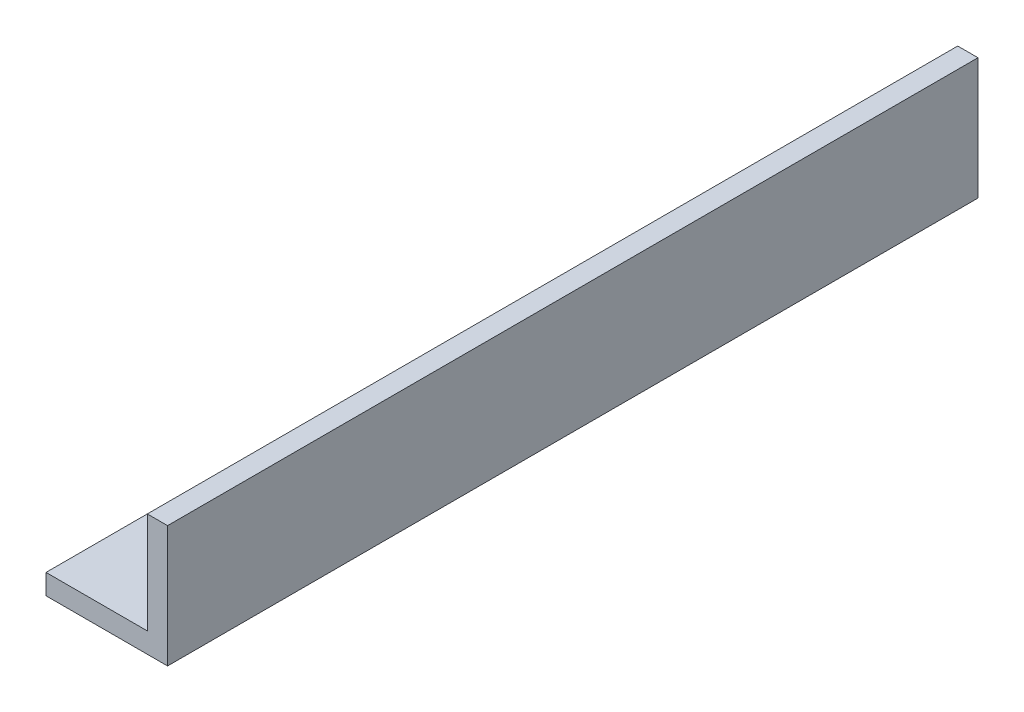
from build123d import *

# Parameters (mm, degrees)
EXTRUDE_THIN1_DEPTH = 127


with BuildPart() as part:
    # Sketch1 → Extrude-Thin1 (new body)
    with BuildSketch(Plane.XY):
        Polygon((0, 0), (19.05, 0), (19.05, 19.05), (15.875, 19.05), (15.875, 3.175), (0, 3.175), align=None)
    extrude(amount=EXTRUDE_THIN1_DEPTH)


solid = part.part
